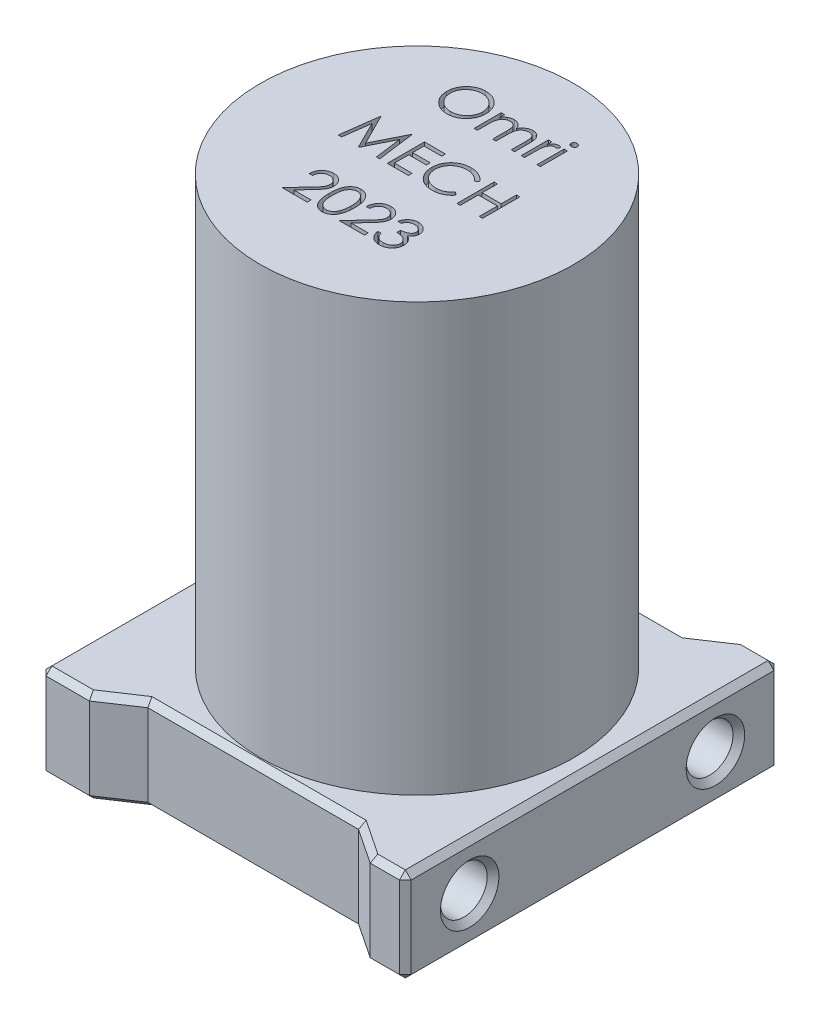
from build123d import *

# Parameters (mm, degrees)
SKETCH1_R                 = 13.4
BOSS_EXTRUDE1_DEPTH       = 36.5
SKETCH2_W                 = 31.2
SKETCH2_H                 = 32
BOSS_EXTRUDE3_DEPTH       = 8
F_4_0MM_DOWEL_HOLE1_D     = 4
F_4_0MM_DOWEL_HOLE1_DEPTH = 10
F_4_0MM_DOWEL_HOLE1_TIP   = 1.201721238
F_4_0MM_DOWEL_HOLE2_D     = 4
F_4_0MM_DOWEL_HOLE2_DEPTH = 10
F_4_0MM_DOWEL_HOLE2_TIP   = 1.201721238
SKETCH12_W                = 0.284935898
SKETCH12_H                = 2.320192308
CUT_EXTRUDE1_DEPTH        = 1
CUT_EXTRUDE2_DEPTH        = 8
CHAMFER2_SIZE             = 0.5


with BuildPart() as part:
    # Sketch1 → Boss-Extrude1 (new body)
    with BuildSketch(Plane(origin=(0, 0, 0), x_dir=(1, 0, 0), z_dir=(0, 1, 0))):
        with Locations(Location((0, 0, 0), (0, 0, 270))):
            Circle(SKETCH1_R)
    extrude(amount=BOSS_EXTRUDE1_DEPTH)

    # Sketch2 → Boss-Extrude3 (add)
    with BuildSketch(Plane.XZ):
        with Locations((-0.6, 0)):
            Rectangle(SKETCH2_W, SKETCH2_H)
    extrude(amount=BOSS_EXTRUDE3_DEPTH)

    # Ø4.0mm Dowel Hole1
    with Locations(Plane.ZY.offset(16.2)):
        with Locations((-10.5, -4), (10.5, -4)):
            Hole(F_4_0MM_DOWEL_HOLE1_D / 2, depth=F_4_0MM_DOWEL_HOLE1_DEPTH)
            with Locations((0, 0, -(F_4_0MM_DOWEL_HOLE1_DEPTH + F_4_0MM_DOWEL_HOLE1_TIP / 2))):  # 118° drill point
                Cone(0, F_4_0MM_DOWEL_HOLE1_D / 2, F_4_0MM_DOWEL_HOLE1_TIP, mode=Mode.SUBTRACT)

    # Ø4.0mm Dowel Hole2
    with Locations(Plane(origin=(15, 0, 0), x_dir=(0, 0, -1), z_dir=(1, 0, 0))):
        with Locations((-10.5, -4), (10.5, -4)):
            Hole(F_4_0MM_DOWEL_HOLE2_D / 2, depth=F_4_0MM_DOWEL_HOLE2_DEPTH)
            with Locations((0, 0, -(F_4_0MM_DOWEL_HOLE2_DEPTH + F_4_0MM_DOWEL_HOLE2_TIP / 2))):  # 118° drill point
                Cone(0, F_4_0MM_DOWEL_HOLE2_D / 2, F_4_0MM_DOWEL_HOLE2_TIP, mode=Mode.SUBTRACT)

    # Sketch12 → Cut-Extrude1 (cut)
    # profile 1 of 13: a face of its own
    with BuildSketch(Plane(origin=(0, 36.5, 0), x_dir=(1, 0, 0), z_dir=(0, 1, 0))):
        with BuildLine():
            add(Edge.make_bspline(
                [(-3.195352564, 9.066098338), (-3.136562354, 9.064609281), (-3.02109353, 9.061684652), (-2.851389873, 9.03929718), (-2.689378608, 9.000566361), (-2.533739982, 8.948983513), (-2.386335639, 8.880172749), (-2.246056072, 8.797001222), (-2.113235051, 8.698597577), (-1.989662798, 8.585722493), (-1.876581136, 8.46291036), (-1.776953367, 8.331848255), (-1.693457858, 8.193328628), (-1.624890751, 8.047767731), (-1.571098441, 7.89549476), (-1.533979023, 7.735697915), (-1.510267987, 7.56941256), (-1.50749596, 7.455995333), (-1.506089744, 7.398460117)],
                knots=[0, 0, 0, 0, 1.065120563, 2.091984664, 3.0946048, 4.079830382, 5.057816894, 6.036188127, 7.030412546, 8.04752943, 9.064399622, 10.05169764, 11.02544977, 11.989514704, 12.962713494, 13.945757189, 14.957906945, 16, 16, 16, 16], degree=3))
            add(Edge.make_bspline(
                [(-1.506089744, 7.398460117), (-1.507495754, 7.341348719), (-1.510267163, 7.228775537), (-1.534005982, 7.063545413), (-1.571236032, 6.904713138), (-1.624391217, 6.752543868), (-1.692631472, 6.606877078), (-1.776682949, 6.468096055), (-1.875689619, 6.336155303), (-1.988362976, 6.212500243), (-2.111191064, 6.09910968), (-2.242935664, 6.0003047), (-2.38063389, 5.91528353), (-2.526057696, 5.847444054), (-2.677278444, 5.793222383), (-2.835649551, 5.756253926), (-3.000428925, 5.732407822), (-3.112797622, 5.729669597), (-3.169911859, 5.728277825)],
                knots=[0, 0, 0, 0, 1.043624062, 2.057103931, 3.04512605, 4.022047818, 4.998200453, 5.980619268, 6.982898556, 8.009068085, 9.034988726, 10.034168286, 11.015286542, 11.987931943, 12.962482838, 13.94673481, 14.956375938, 16, 16, 16, 16], degree=3))
            add(Edge.make_bspline(
                [(-3.169911859, 5.728277825), (-3.227446777, 5.72968334), (-3.340863416, 5.732453985), (-3.507357726, 5.756204259), (-3.667266823, 5.79334387), (-3.820133413, 5.846420288), (-3.966042742, 5.915015918), (-4.105280174, 5.998658462), (-4.237286829, 6.097906369), (-4.36096827, 6.21054319), (-4.474133614, 6.333163098), (-4.572793905, 6.464548458), (-4.656455258, 6.602121622), (-4.724820567, 6.746264376), (-4.778944755, 6.896279899), (-4.81586984, 7.053168875), (-4.839760311, 7.216036855), (-4.84251335, 7.326928627), (-4.843910256, 7.383195693)],
                knots=[0, 0, 0, 0, 1.053102029, 2.075944431, 3.073151272, 4.055350789, 5.033113405, 6.020478099, 7.024410459, 8.052272461, 9.079885166, 10.07527673, 11.055994387, 12.023226415, 12.992069828, 13.970394897, 14.97016774, 16, 16, 16, 16], degree=3))
            add(Edge.make_bspline(
                [(-4.843910256, 7.383195693), (-4.843425266, 7.420962472), (-4.842461402, 7.496019584), (-4.83085751, 7.607477143), (-4.814019395, 7.717142239), (-4.78988766, 7.824703028), (-4.758326648, 7.929896207), (-4.721086595, 8.033447256), (-4.675602592, 8.134306777), (-4.624185147, 8.232952568), (-4.56679765, 8.327846882), (-4.503410363, 8.41754479), (-4.436249707, 8.50279898), (-4.362622914, 8.581400191), (-4.284956568, 8.655635007), (-4.201990753, 8.724362615), (-4.114231717, 8.788202749), (-4.021301844, 8.845734059), (-3.925490981, 8.897766988), (-3.826724189, 8.942418238), (-3.726342871, 8.980741451), (-3.623876869, 9.011802771), (-3.519598283, 9.03632469), (-3.413279521, 9.053022789), (-3.305005284, 9.064656277), (-3.232060731, 9.065615583), (-3.195352564, 9.066098338)],
                knots=[0, 0, 0, 0, 1.037015668, 2.060948919, 3.074880161, 4.083647147, 5.086022904, 6.090072063, 7.104153813, 8.122640571, 9.144368836, 10.147691507, 11.138137339, 12.123020368, 13.103399296, 14.087645067, 15.080126199, 16.082011238, 17.087798457, 18.072939717, 19.057185487, 20.037253025, 21.01195951, 21.997135196, 22.992090687, 24, 24, 24, 24], degree=3))
        make_face()
        with BuildLine():
            add(Edge.make_bspline(
                [(-3.181360176, 8.740457312), (-3.211490594, 8.740090019), (-3.27146338, 8.739358944), (-3.360621495, 8.729728973), (-3.448607035, 8.716004002), (-3.535438171, 8.69642648), (-3.62075159, 8.669752803), (-3.705342518, 8.639054265), (-3.788439574, 8.601660847), (-3.869768431, 8.559412751), (-3.94861282, 8.512650516), (-4.023010057, 8.460968984), (-4.093152741, 8.405580153), (-4.158869133, 8.346354758), (-4.219966267, 8.28299119), (-4.277646675, 8.216450052), (-4.329598367, 8.144829408), (-4.377210283, 8.070071396), (-4.419816824, 7.99227339), (-4.457703967, 7.912254444), (-4.488695604, 7.829361828), (-4.513970759, 7.744494842), (-4.534925588, 7.657787896), (-4.548200647, 7.568583234), (-4.557936431, 7.477329096), (-4.558625719, 7.415659843), (-4.558974359, 7.384467729)],
                knots=[0, 0, 0, 0, 1.008559885, 2.007477868, 2.99961109, 3.989939068, 4.984837346, 5.991145699, 7.001802488, 8.033829008, 9.059044045, 10.069351652, 11.065060232, 12.050310815, 13.029377138, 14.011219647, 14.996725999, 15.989392538, 16.977580475, 17.965360261, 18.951710183, 19.937753436, 20.929683414, 21.935841486, 22.955955122, 24, 24, 24, 24], degree=3))
            add(Edge.make_bspline(
                [(-4.558974359, 7.384467729), (-4.557817877, 7.338600571), (-4.555542719, 7.248365683), (-4.535624066, 7.116133153), (-4.504942704, 6.989053064), (-4.45971495, 6.867820761), (-4.403154035, 6.751394161), (-4.333279642, 6.640806095), (-4.250494614, 6.536026673), (-4.156456987, 6.437787394), (-4.053657103, 6.348120128), (-3.944498126, 6.269413322), (-3.830149497, 6.202819738), (-3.71031302, 6.148567994), (-3.585628467, 6.105578732), (-3.455292403, 6.076115974), (-3.320173057, 6.056725382), (-3.228070249, 6.054863239), (-3.181360176, 6.053918851)],
                knots=[0, 0, 0, 0, 1.032063989, 2.030389145, 3.003944642, 3.970395727, 4.937377036, 5.913328081, 6.909231446, 7.93887556, 8.970685674, 9.976071282, 10.964166581, 11.944589148, 12.933237628, 13.927779006, 14.949070134, 16, 16, 16, 16], degree=3))
            add(Edge.make_bspline(
                [(-3.181360176, 6.053918851), (-3.149964414, 6.054350201), (-3.087697188, 6.055205698), (-2.995081964, 6.063822355), (-2.904135258, 6.077639837), (-2.814984633, 6.097534074), (-2.727731268, 6.122432612), (-2.642010982, 6.152012479), (-2.558736819, 6.188916142), (-2.476858252, 6.229690356), (-2.398484518, 6.276172499), (-2.323667428, 6.326099963), (-2.25429279, 6.381407212), (-2.18862556, 6.439752656), (-2.127277585, 6.502312718), (-2.070663721, 6.569006062), (-2.018974601, 6.640253658), (-1.971380765, 6.714898276), (-1.928923519, 6.792909163), (-1.891931051, 6.873218228), (-1.860547431, 6.95562772), (-1.835212288, 7.040256502), (-1.815359048, 7.126943844), (-1.801679406, 7.215805815), (-1.792110465, 7.306664647), (-1.791389217, 7.368118002), (-1.791025641, 7.399096134)],
                knots=[0, 0, 0, 0, 1.047197238, 2.076906641, 3.100256066, 4.114471768, 5.12198147, 6.126382909, 7.136867548, 8.15857795, 9.17633901, 10.174870724, 11.156907918, 12.133735059, 13.104061851, 14.077631395, 15.04955518, 16.038496417, 17.029181396, 18.010275684, 18.986308667, 19.968651475, 20.955262928, 21.950658345, 22.966943676, 24, 24, 24, 24], degree=3))
            add(Edge.make_bspline(
                [(-1.791025641, 7.399096134), (-1.791389508, 7.429862342), (-1.792111305, 7.490892781), (-1.801674835, 7.581117952), (-1.8153735, 7.669340509), (-1.835115385, 7.755214101), (-1.860560882, 7.83876062), (-1.891936531, 7.919901599), (-1.928934625, 7.998939318), (-1.971396371, 8.075678431), (-2.019126439, 8.149315515), (-2.071281932, 8.219711989), (-2.128763354, 8.285545833), (-2.189928391, 8.348442305), (-2.256304837, 8.407059962), (-2.327592018, 8.461418249), (-2.402924497, 8.512829005), (-2.482687061, 8.559207193), (-2.56500479, 8.602037247), (-2.649472452, 8.638732085), (-2.735133136, 8.669912508), (-2.821769009, 8.696507183), (-2.910109282, 8.715927325), (-2.999557041, 8.729741342), (-3.089988533, 8.739355592), (-3.150806311, 8.740088907), (-3.181360176, 8.740457312)],
                knots=[0, 0, 0, 0, 1.02996197, 2.043119294, 3.035359645, 4.018872909, 4.991431989, 5.957985074, 6.929999688, 7.912076566, 8.892894881, 9.867085534, 10.843653904, 11.817741046, 12.803660682, 13.806313499, 14.818574707, 15.856120519, 16.894564902, 17.924820532, 18.937903209, 19.946497019, 20.957711757, 21.963978472, 22.977135795, 24, 24, 24, 24], degree=3))
        make_face(mode=Mode.SUBTRACT)
    # profile 2 of 13: a face of its own
    with BuildSketch(Plane(origin=(0, 36.5, 0), x_dir=(1, 0, 0), z_dir=(0, 1, 0))):
        with BuildLine():
            Line((-0.936217949, 8.129880389), (-0.651282051, 8.129880389))
            Line((-0.651282051, 8.129880389), (-0.651282051, 7.726645213))
            add(Edge.make_bspline(
                [(-0.651282051, 7.726645213), (-0.625624468, 7.761921823), (-0.576462079, 7.82951519), (-0.495848237, 7.918587805), (-0.415315621, 7.994178345), (-0.35731891, 8.033859379), (-0.329457131, 8.052922256)],
                knots=[0, 0, 0, 0, 1.134379233, 2.173579362, 3.122582517, 4, 4, 4, 4], degree=3))
            add(Edge.make_bspline(
                [(-0.329457131, 8.052922256), (-0.291479902, 8.07106998), (-0.21618895, 8.107048367), (-0.096972939, 8.143545952), (0.025014797, 8.165975151), (0.107390819, 8.16904254), (0.148828125, 8.170585517)],
                knots=[0, 0, 0, 0, 1.014936303, 2.012140481, 3.000054389, 4, 4, 4, 4], degree=3))
            add(Edge.make_bspline(
                [(0.148828125, 8.170585517), (0.176852486, 8.169637289), (0.23231119, 8.167760797), (0.3144839, 8.155550622), (0.394184212, 8.134444879), (0.470941225, 8.105046807), (0.54325927, 8.069444455), (0.609561613, 8.027670792), (0.669092145, 7.980774159), (0.721820777, 7.926636841), (0.76923625, 7.863738641), (0.812850633, 7.790383215), (0.853150647, 7.704923408), (0.875485691, 7.642905189), (0.887244591, 7.610253987)],
                knots=[0, 0, 0, 0, 1.009824226, 1.998387844, 2.986035974, 3.974953746, 4.955485308, 5.885931332, 6.793869504, 7.679848016, 8.601185859, 9.625726857, 10.749998409, 12, 12, 12, 12], degree=3))
            add(Edge.make_bspline(
                [(0.887244591, 7.610253987), (0.899682655, 7.632682567), (0.924159018, 7.676818863), (0.965257703, 7.739283144), (1.008317775, 7.797709305), (1.053706208, 7.852143705), (1.101262798, 7.902317531), (1.151211354, 7.948396671), (1.203267548, 7.990579008), (1.275650509, 8.039857874), (1.369823374, 8.092201088), (1.488557592, 8.137584034), (1.612065248, 8.165629379), (1.695901303, 8.168922555), (1.738236178, 8.170585517)],
                knots=[0, 0, 0, 0, 0.86119277, 1.694706429, 2.50939023, 3.298075842, 4.073795165, 4.829715201, 5.57930267, 6.321991688, 7.768977793, 9.186738141, 10.579381044, 12, 12, 12, 12], degree=3))
            add(Edge.make_bspline(
                [(1.738236178, 8.170585517), (1.777135791, 8.169118467), (1.85326611, 8.166247307), (1.964098343, 8.143701656), (2.067459838, 8.104986933), (2.163142614, 8.052160706), (2.249466159, 7.985776732), (2.324501669, 7.906792858), (2.387793355, 7.815767765), (2.429139693, 7.730140746), (2.457184254, 7.654543694), (2.474475516, 7.590130844), (2.489751526, 7.519236221), (2.502434512, 7.441775056), (2.511704199, 7.357473718), (2.518571919, 7.266470166), (2.523220186, 7.168693672), (2.523548637, 7.10123354), (2.523717949, 7.066458915)],
                knots=[0, 0, 0, 0, 1.209669288, 2.367440248, 3.500751976, 4.631527125, 5.755587489, 6.87532382, 8.007944318, 9.190864318, 9.82315674, 10.514484317, 11.263564316, 12.079023757, 12.955305781, 13.901327259, 14.918167583, 16, 16, 16, 16], degree=3))
            Line((2.523717949, 7.066458915), (2.523717949, 5.809688081))
            Line((2.523717949, 5.809688081), (2.238782051, 5.809688081))
            Line((2.238782051, 5.809688081), (2.238782051, 7.06773095))
            add(Edge.make_bspline(
                [(2.238782051, 7.06773095), (2.2387114, 7.097413185), (2.23857562, 7.154457926), (2.236132111, 7.236329793), (2.231528076, 7.310958945), (2.226144511, 7.378243625), (2.218666198, 7.438340741), (2.209008817, 7.491129577), (2.198778351, 7.537025392), (2.18178213, 7.587903449), (2.154615114, 7.644028569), (2.113233543, 7.704556384), (2.061099947, 7.757243967), (2.000901805, 7.802980583), (1.932368573, 7.840167672), (1.856835574, 7.866725195), (1.774771756, 7.883165235), (1.71796394, 7.884803549), (1.688626803, 7.88564962)],
                knots=[0, 0, 0, 0, 1.253487763, 2.409012846, 3.458416907, 4.410876679, 5.259312806, 6.014470957, 6.676830364, 7.243083969, 8.276244668, 9.299465089, 10.325150304, 11.392391894, 12.482080715, 13.603491619, 14.762376348, 16, 16, 16, 16], degree=3))
            add(Edge.make_bspline(
                [(1.688626803, 7.88564962), (1.652640487, 7.884364963), (1.581517846, 7.881825992), (1.477699441, 7.855905407), (1.377940019, 7.816825466), (1.285216291, 7.760190308), (1.199919652, 7.692328435), (1.126532178, 7.611638445), (1.065905838, 7.520352725), (1.024854017, 7.43585536), (0.998919437, 7.359955221), (0.981795378, 7.293645462), (0.968475444, 7.218278611), (0.955983607, 7.134361102), (0.947830454, 7.041315295), (0.940420573, 6.939571603), (0.936954504, 6.828824011), (0.936469674, 6.752055515), (0.936217949, 6.712197096)],
                knots=[0, 0, 0, 0, 1.090531906, 2.155305635, 3.229839962, 4.33261226, 5.44038871, 6.529323825, 7.629011124, 8.757537029, 9.370236727, 10.061839251, 10.834451254, 11.692844982, 12.636905849, 13.66920014, 14.789842145, 16, 16, 16, 16], degree=3))
            Line((0.936217949, 6.712197096), (0.936217949, 5.809688081))
            Line((0.936217949, 5.809688081), (0.651282051, 5.809688081))
            Line((0.651282051, 5.809688081), (0.651282051, 6.989500782))
            add(Edge.make_bspline(
                [(0.651282051, 6.989500782), (0.651209996, 7.022786864), (0.651071369, 7.08682594), (0.648643567, 7.178659345), (0.644029274, 7.262190039), (0.638694777, 7.337320939), (0.631020186, 7.403915501), (0.622302759, 7.462330746), (0.612007948, 7.512420227), (0.594962839, 7.567359869), (0.568914714, 7.627885278), (0.527015362, 7.692420347), (0.474757057, 7.748906407), (0.41346062, 7.797128986), (0.344512608, 7.836990187), (0.268327666, 7.865710105), (0.18559178, 7.882423567), (0.128552719, 7.884553989), (0.09921875, 7.88564962)],
                knots=[0, 0, 0, 0, 1.320475261, 2.540461679, 3.643808994, 4.639130445, 5.527981419, 6.302341397, 6.981980563, 7.553956391, 8.582137848, 9.585246428, 10.591171744, 11.620968678, 12.668337649, 13.738356861, 14.836885341, 16, 16, 16, 16], degree=3))
            add(Edge.make_bspline(
                [(0.09921875, 7.88564962), (0.064732615, 7.884261274), (-0.003997026, 7.88149435), (-0.104963813, 7.856589401), (-0.202468683, 7.817578562), (-0.29495616, 7.763458583), (-0.379931995, 7.696421562), (-0.454325209, 7.617577335), (-0.516865928, 7.527907141), (-0.558351217, 7.444300758), (-0.585110547, 7.370302144), (-0.602886315, 7.307390927), (-0.618162262, 7.237540702), (-0.629514267, 7.160535966), (-0.64047293, 7.076878259), (-0.645761853, 6.986150829), (-0.65090677, 6.888431506), (-0.651153889, 6.820964983), (-0.651282051, 6.785975141)],
                knots=[0, 0, 0, 0, 1.098833095, 2.189935336, 3.297829714, 4.440610912, 5.596351641, 6.740013378, 7.886572111, 9.072425424, 9.705826452, 10.395263256, 11.156850408, 11.985370555, 12.878090359, 13.847760091, 14.883794034, 16, 16, 16, 16], degree=3))
            Line((-0.651282051, 6.785975141), (-0.651282051, 5.809688081))
            Line((-0.651282051, 5.809688081), (-0.936217949, 5.809688081))
            Line((-0.936217949, 5.809688081), (-0.936217949, 8.129880389))
        make_face()
    # profile 3 of 13: a face of its own
    with BuildSketch(Plane(origin=(0, 36.5, 0), x_dir=(1, 0, 0), z_dir=(0, 1, 0))):
        with BuildLine():
            Line((3.093589744, 8.129880389), (3.378525641, 8.129880389))
            Line((3.378525641, 8.129880389), (3.378525641, 7.788338923))
            add(Edge.make_bspline(
                [(3.378525641, 7.788338923), (3.399561158, 7.820139567), (3.43979142, 7.880958052), (3.506659578, 7.961393775), (3.575151885, 8.02799171), (3.645596234, 8.081062759), (3.718510653, 8.120807517), (3.792294888, 8.149920485), (3.868109778, 8.167135621), (3.919056667, 8.169434011), (3.94458133, 8.170585517)],
                knots=[0, 0, 0, 0, 1.2804753, 2.448899062, 3.506932113, 4.484331642, 5.4025378, 6.288909075, 7.142734305, 8, 8, 8, 8], degree=3))
            add(Edge.make_bspline(
                [(3.94458133, 8.170585517), (3.964380926, 8.16950554), (4.005119882, 8.167283415), (4.066789803, 8.151670739), (4.13032922, 8.126744247), (4.171279814, 8.103303473), (4.192628205, 8.091083314)],
                knots=[0, 0, 0, 0, 0.901110191, 1.854092781, 2.881294221, 4, 4, 4, 4], degree=3))
            Line((4.192628205, 8.091083314), (4.036167869, 7.844308474))
            add(Edge.make_bspline(
                [(4.036167869, 7.844308474), (4.022461828, 7.850422858), (3.996445139, 7.86202913), (3.958386354, 7.875765096), (3.923296856, 7.883853106), (3.900941628, 7.885078399), (3.890519832, 7.88564962)],
                knots=[0, 0, 0, 0, 1.180555205, 2.24091978, 3.179933427, 4, 4, 4, 4], degree=3))
            add(Edge.make_bspline(
                [(3.890519832, 7.88564962), (3.867654631, 7.884125586), (3.821016248, 7.881016998), (3.752541024, 7.856579651), (3.686095345, 7.817096041), (3.633325337, 7.773307246), (3.592465579, 7.731081744), (3.563309803, 7.694207836), (3.536564739, 7.652861506), (3.511010325, 7.607749579), (3.48772733, 7.55810179), (3.465997023, 7.504414161), (3.44634934, 7.446624508), (3.435145904, 7.406363222), (3.429407051, 7.385739764)],
                knots=[0, 0, 0, 0, 1.125678352, 2.296057538, 3.5422874, 4.923748041, 5.663163013, 6.437101912, 7.23742474, 8.08941207, 8.991984279, 9.93940061, 10.944477711, 12, 12, 12, 12], degree=3))
            add(Edge.make_bspline(
                [(3.429407051, 7.385739764), (3.425114094, 7.367345471), (3.415605521, 7.326603509), (3.406360341, 7.258251633), (3.397225849, 7.177494457), (3.390788203, 7.084107191), (3.384820979, 6.978323045), (3.381455404, 6.859980866), (3.378640412, 6.728959183), (3.378565059, 6.63736102), (3.378525641, 6.589445693)],
                knots=[0, 0, 0, 0, 0.566838948, 1.255505196, 2.06880316, 3.007127437, 4.065329342, 5.249902469, 6.561414163, 8, 8, 8, 8], degree=3))
            Line((3.378525641, 6.589445693), (3.378525641, 5.809688081))
            Line((3.378525641, 5.809688081), (3.093589744, 5.809688081))
            Line((3.093589744, 5.809688081), (3.093589744, 8.129880389))
        make_face()
    # profile 4 of 13: a face of its own
    with BuildSketch(Plane(origin=(0, 36.5, 0), x_dir=(1, 0, 0), z_dir=(0, 1, 0))):
        with BuildLine():
            add(Edge.make_bspline(
                [(4.578054888, 9.106803466), (4.595736296, 9.105983271), (4.630359888, 9.10437717), (4.680428067, 9.090623545), (4.726018356, 9.067310259), (4.766456728, 9.036032262), (4.801156654, 8.999248124), (4.825450584, 8.956375675), (4.841064686, 8.910058195), (4.842950233, 8.877750221), (4.843910256, 8.861300661)],
                knots=[0, 0, 0, 0, 1.055194115, 2.066272739, 3.074728998, 4.095836921, 5.109056067, 6.073838105, 7.019297344, 8, 8, 8, 8], degree=3))
            add(Edge.make_bspline(
                [(4.843910256, 8.861300661), (4.842928583, 8.845278112), (4.84098793, 8.813603427), (4.825462645, 8.768088921), (4.800949615, 8.725812178), (4.766478979, 8.689099462), (4.72601246, 8.657838757), (4.680429633, 8.634520886), (4.630359476, 8.620768476), (4.595736156, 8.619162208), (4.578054888, 8.618341927)],
                knots=[0, 0, 0, 0, 0.96129708, 1.900370562, 2.859976407, 3.87933698, 4.906634145, 5.921202961, 6.938410037, 8, 8, 8, 8], degree=3))
            add(Edge.make_bspline(
                [(4.578054888, 8.618341927), (4.56057581, 8.619130888), (4.526555068, 8.620666496), (4.477236575, 8.634790727), (4.432035017, 8.657846736), (4.391517778, 8.688894775), (4.357744674, 8.726037646), (4.333162622, 8.76806312), (4.317673192, 8.813609996), (4.315727708, 8.845280318), (4.31474359, 8.861300661)],
                knots=[0, 0, 0, 0, 1.054934014, 2.053291228, 3.073705704, 4.106921865, 5.123545215, 6.088680038, 7.033164197, 8, 8, 8, 8], degree=3))
            add(Edge.make_bspline(
                [(4.31474359, 8.861300661), (4.315706147, 8.877747932), (4.31759667, 8.91005141), (4.333174232, 8.956401904), (4.357539915, 8.999020838), (4.391540141, 9.036236826), (4.432029065, 9.067302328), (4.477238113, 9.090353718), (4.526554661, 9.104479147), (4.560575672, 9.10601459), (4.578054888, 9.106803466)],
                knots=[0, 0, 0, 0, 0.98631895, 1.937192651, 2.907499808, 3.917963147, 4.944918757, 5.95915025, 6.951458133, 8, 8, 8, 8], degree=3))
        make_face()
    # profile 5 of 13: a face of its own
    with BuildSketch(Plane(origin=(0, 36.5, 0), x_dir=(1, 0, 0), z_dir=(0, 1, 0))):
        with Locations((4.579326923, 6.969784235)):
            Rectangle(SKETCH12_W, SKETCH12_H)
    # profile 6 of 13: a face of its own
    with BuildSketch(Plane(origin=(0, 36.5, 0), x_dir=(1, 0, 0), z_dir=(0, 1, 0))):
        Polygon((-6.248237179, -0.481978585), (-5.829101563, 2.693021415), (-5.788396434, 2.693021415), (-4.477564103, 0.08789321), (-3.169911859, 2.693021415), (-3.128570713, 2.693021415), (-2.706891026, -0.481978585), (-2.993098958, -0.481978585), (-3.297115385, 1.802596735), (-4.443219151, -0.481978585), (-4.507456931, -0.481978585), (-5.658012821, 1.807684876), (-5.961393229, -0.481978585), align=None)
    # profile 7 of 13: a face of its own
    with BuildSketch(Plane(origin=(0, 36.5, 0), x_dir=(1, 0, 0), z_dir=(0, 1, 0))):
        Polygon((-2.055608974, 2.693021415), (-0.264583333, 2.693021415), (-0.264583333, 2.367380389), (-1.770673077, 2.367380389), (-1.770673077, 1.390457312), (-0.264583333, 1.390457312), (-0.264583333, 1.064816286), (-1.770673077, 1.064816286), (-1.770673077, -0.15633756), (-0.264583333, -0.15633756), (-0.264583333, -0.481978585), (-2.055608974, -0.481978585), align=None)
    # profile 8 of 13: a face of its own
    with BuildSketch(Plane(origin=(0, 36.5, 0), x_dir=(1, 0, 0), z_dir=(0, 1, 0))):
        with BuildLine():
            Line((3.236057692, 2.110429267), (2.986738782, 1.919623979))
            add(Edge.make_bspline(
                [(2.986738782, 1.919623979), (2.96895344, 1.940820251), (2.933622542, 1.982927025), (2.876781694, 2.042054183), (2.817543775, 2.097449099), (2.75593143, 2.149375661), (2.690835657, 2.196018013), (2.623833361, 2.239806799), (2.553803706, 2.279056819), (2.456964632, 2.326648242), (2.330284084, 2.376310825), (2.170813052, 2.417951614), (2.004342269, 2.444459394), (1.890770161, 2.447330358), (1.833002804, 2.448790645)],
                knots=[0, 0, 0, 0, 0.757959112, 1.505699292, 2.245454638, 2.979532153, 3.711538275, 4.438200793, 5.171680507, 5.909471876, 7.393775596, 8.890124382, 10.418191784, 12, 12, 12, 12], degree=3))
            add(Edge.make_bspline(
                [(1.833002804, 2.448790645), (1.80117724, 2.448424194), (1.737821483, 2.447694691), (1.64379751, 2.438070699), (1.551529242, 2.424544101), (1.461076698, 2.404473273), (1.372555014, 2.379098111), (1.285385478, 2.348776485), (1.200830148, 2.311261738), (1.117719318, 2.269797816), (1.038091034, 2.222964349), (0.96274824, 2.171880094), (0.891965726, 2.117116699), (0.8256875, 2.05846891), (0.763845804, 1.996200846), (0.706888743, 1.929648907), (0.655013407, 1.859025864), (0.607191534, 1.785262987), (0.56436284, 1.708575133), (0.528503592, 1.628678462), (0.496748946, 1.546941169), (0.471621776, 1.462439759), (0.451733107, 1.375768821), (0.438010155, 1.286695749), (0.428495614, 1.195406625), (0.427769739, 1.133531035), (0.427403846, 1.102341327)],
                knots=[0, 0, 0, 0, 1.054917814, 2.100044995, 3.131103042, 4.146048494, 5.169673617, 6.183595914, 7.203665975, 8.234915748, 9.262203917, 10.264457458, 11.251630812, 12.227803204, 13.197192746, 14.159520551, 15.12972552, 16.100847026, 17.073214652, 18.039054194, 19.002613845, 19.979014051, 20.95965708, 21.949030935, 22.966165397, 24, 24, 24, 24], degree=3))
            add(Edge.make_bspline(
                [(0.427403846, 1.102341327), (0.428548496, 1.055413629), (0.430795865, 0.96327732), (0.450796854, 0.828321123), (0.481190758, 0.699034512), (0.52674346, 0.576225655), (0.582912884, 0.458380216), (0.653888296, 0.347492113), (0.736090441, 0.241885658), (0.830682236, 0.144056699), (0.934464654, 0.054690676), (1.045814546, -0.024004494), (1.164454578, -0.089604423), (1.289074807, -0.144192603), (1.42063421, -0.186154063), (1.55889621, -0.215694375), (1.703560091, -0.234964068), (1.802410904, -0.236808913), (1.852719351, -0.237747816)],
                knots=[0, 0, 0, 0, 1.029171465, 2.020641659, 2.987623507, 3.938342917, 4.889210282, 5.84687017, 6.821220943, 7.821438502, 8.827599549, 9.822697543, 10.807740252, 11.797342354, 12.80366471, 13.83203677, 14.896651826, 16, 16, 16, 16], degree=3))
            add(Edge.make_bspline(
                [(1.852719351, -0.237747816), (1.908148219, -0.236215852), (2.01724549, -0.233200579), (2.177236486, -0.207656117), (2.330394645, -0.166237863), (2.476728205, -0.108273319), (2.615824634, -0.032921237), (2.747901605, 0.058426123), (2.873070601, 0.166637682), (2.948337407, 0.249263092), (2.986738782, 0.291418851)],
                knots=[0, 0, 0, 0, 1.028121516, 2.023589091, 2.998037872, 3.967518031, 4.937445131, 5.927275754, 6.942489185, 8, 8, 8, 8], degree=3))
            Line((2.986738782, 0.291418851), (3.236057692, 0.102521615))
            add(Edge.make_bspline(
                [(3.236057692, 0.102521615), (3.215993407, 0.076633162), (3.175960943, 0.024980261), (3.111138313, -0.047837647), (3.042851051, -0.116330594), (2.970591942, -0.179946365), (2.895192231, -0.239957915), (2.815298062, -0.294660291), (2.731959726, -0.344817022), (2.645459591, -0.390742875), (2.555889564, -0.431489234), (2.463356969, -0.466372295), (2.368260662, -0.496421302), (2.270596293, -0.521142702), (2.170161285, -0.540438614), (2.067318069, -0.55333789), (1.961844683, -0.562175198), (1.890687108, -0.562980665), (1.854627404, -0.563388842)],
                knots=[0, 0, 0, 0, 0.986787822, 1.968848986, 2.935600012, 3.899624008, 4.868462664, 5.837806735, 6.815139263, 7.798259679, 8.787526145, 9.778297419, 10.776456485, 11.791383307, 12.812564526, 13.85620153, 14.913611965, 16, 16, 16, 16], degree=3))
            add(Edge.make_bspline(
                [(1.854627404, -0.563388842), (1.82047922, -0.563151177), (1.752955416, -0.562681225), (1.653261548, -0.55506833), (1.556206714, -0.544681783), (1.462068303, -0.529042521), (1.370332597, -0.510587298), (1.28183121, -0.485848373), (1.195693269, -0.458135914), (1.112264846, -0.425564962), (1.031474975, -0.388810997), (0.953584232, -0.347271511), (0.87862844, -0.301295819), (0.805870665, -0.251897346), (0.736385714, -0.197489365), (0.669571445, -0.138827489), (0.605053199, -0.076109437), (0.565136477, -0.030883962), (0.545067107, -0.008145452)],
                knots=[0, 0, 0, 0, 1.114604814, 2.203992996, 3.262667896, 4.300477797, 5.318619304, 6.316056647, 7.298880507, 8.271930387, 9.238335007, 10.195173496, 11.151986948, 12.108099108, 13.064862484, 14.031167946, 15.010108607, 16, 16, 16, 16], degree=3))
            add(Edge.make_bspline(
                [(0.545067107, -0.008145452), (0.512921916, 0.031352626), (0.44901962, 0.109871928), (0.36726275, 0.237131354), (0.297278896, 0.369998943), (0.240695025, 0.509172736), (0.19646026, 0.654340437), (0.16581589, 0.805575225), (0.145902649, 0.962735858), (0.143625458, 1.069630659), (0.142467949, 1.123965926)],
                knots=[0, 0, 0, 0, 0.994628077, 1.977248131, 2.950237994, 3.925870899, 4.908910175, 5.911660606, 6.938484602, 8, 8, 8, 8], degree=3))
            add(Edge.make_bspline(
                [(0.142467949, 1.123965926), (0.143878731, 1.181075516), (0.146654358, 1.293435069), (0.170236259, 1.458330012), (0.208171881, 1.61631021), (0.262053344, 1.767080749), (0.330366056, 1.911434647), (0.414754484, 2.048269168), (0.514238249, 2.178459408), (0.628037114, 2.300029932), (0.752830339, 2.411190631), (0.886469549, 2.508986258), (1.028693172, 2.590372862), (1.177934366, 2.658405095), (1.335310663, 2.710696858), (1.500486291, 2.747302963), (1.673150878, 2.770087776), (1.79095465, 2.772968143), (1.850811298, 2.774431671)],
                knots=[0, 0, 0, 0, 1.032925535, 2.032216505, 3.007276963, 3.968222605, 4.92396291, 5.891752235, 6.871517503, 7.883894988, 8.900124299, 9.891468569, 10.874487609, 11.85992873, 12.854644235, 13.869047385, 14.917252991, 16, 16, 16, 16], degree=3))
            add(Edge.make_bspline(
                [(1.850811298, 2.774431671), (1.887291569, 2.773994303), (1.959500592, 2.773128576), (2.066319069, 2.764686576), (2.170316037, 2.750613519), (2.271563142, 2.731458227), (2.370552944, 2.707684443), (2.466528877, 2.676714315), (2.560054114, 2.641302604), (2.65053881, 2.600518853), (2.737548823, 2.554738309), (2.821057055, 2.504468422), (2.900400177, 2.449771513), (2.976136489, 2.391112775), (3.046999052, 2.327251225), (3.114999822, 2.259943406), (3.177829514, 2.187250579), (3.21661277, 2.136083247), (3.236057692, 2.110429267)],
                knots=[0, 0, 0, 0, 1.096760587, 2.17092713, 3.219439832, 4.250915756, 5.268269357, 6.278326846, 7.281116186, 8.274029601, 9.260640565, 10.235837813, 11.203064059, 12.156899882, 13.114053108, 14.069676657, 15.032185724, 16, 16, 16, 16], degree=3))
        make_face()
    # profile 9 of 13: a face of its own
    with BuildSketch(Plane(origin=(0, 36.5, 0), x_dir=(1, 0, 0), z_dir=(0, 1, 0))):
        Polygon((3.887339744, 2.693021415), (4.172275641, 2.693021415), (4.172275641, 1.390457312), (5.800480769, 1.390457312), (5.800480769, 2.693021415), (6.085416667, 2.693021415), (6.085416667, -0.481978585), (5.800480769, -0.481978585), (5.800480769, 1.064816286), (4.172275641, 1.064816286), (4.172275641, -0.481978585), (3.887339744, -0.481978585), align=None)
    # profile 10 of 13: a face of its own
    with BuildSketch(Plane(origin=(0, 36.5, 0), x_dir=(1, 0, 0), z_dir=(0, 1, 0))):
        with BuildLine():
            Line((-4.355448718, -4.575568329), (-4.640384615, -4.575568329))
            add(Edge.make_bspline(
                [(-4.640384615, -4.575568329), (-4.638527555, -4.537766881), (-4.634880338, -4.463525843), (-4.61780039, -4.355282013), (-4.593361166, -4.251818017), (-4.558806775, -4.153964595), (-4.515893223, -4.060856534), (-4.464430984, -3.972863663), (-4.403476563, -3.890321656), (-4.334346168, -3.813995705), (-4.259263189, -3.743975552), (-4.178249944, -3.683509724), (-4.093119097, -3.632421551), (-4.004128928, -3.589712139), (-3.910275417, -3.55765385), (-3.812410253, -3.533867077), (-3.710103465, -3.519555678), (-3.640398588, -3.518017358), (-3.604947917, -3.517234996)],
                knots=[0, 0, 0, 0, 1.10065271, 2.161652631, 3.183658789, 4.190468796, 5.17591951, 6.163126047, 7.15150782, 8.156236427, 9.156009102, 10.134482811, 11.092018607, 12.041330605, 13.001268258, 13.972401359, 14.968799086, 16, 16, 16, 16], degree=3))
            add(Edge.make_bspline(
                [(-3.604947917, -3.517234996), (-3.570133521, -3.518050024), (-3.501724477, -3.519651526), (-3.401882507, -3.533404745), (-3.306834532, -3.554945389), (-3.216766344, -3.585167231), (-3.132396557, -3.625793104), (-3.053091367, -3.674595157), (-2.977906631, -3.731037433), (-2.91022762, -3.797489106), (-2.848081005, -3.868429841), (-2.794466817, -3.944165296), (-2.748553447, -4.022387577), (-2.710283195, -4.10369316), (-2.68211084, -4.188847593), (-2.660722037, -4.276611127), (-2.648632169, -4.367892205), (-2.646776678, -4.429674581), (-2.645833333, -4.461085156)],
                knots=[0, 0, 0, 0, 1.111607364, 2.184268762, 3.212621178, 4.221274766, 5.211760367, 6.196651075, 7.1921475, 8.207485113, 9.220403448, 10.201281604, 11.166441695, 12.114753415, 13.065576456, 14.026450734, 14.996634279, 16, 16, 16, 16], degree=3))
            add(Edge.make_bspline(
                [(-2.645833333, -4.461085156), (-2.647369365, -4.505306406), (-2.650414472, -4.592972885), (-2.676462514, -4.721800654), (-2.717144706, -4.846617541), (-2.766128022, -4.947072094), (-2.815542311, -5.02801962), (-2.860071693, -5.094666231), (-2.912200486, -5.166426192), (-2.972687409, -5.243059205), (-3.040281229, -5.325165526), (-3.115594191, -5.412695555), (-3.19916335, -5.504744946), (-3.257817847, -5.567615027), (-3.288211138, -5.600192728)],
                knots=[0, 0, 0, 0, 1.184426356, 2.348067706, 3.509069118, 4.696110526, 5.333549288, 6.050745305, 6.844228056, 7.710549037, 8.667450064, 9.695053472, 10.805634456, 12, 12, 12, 12], degree=3))
            Line((-3.288211138, -5.600192728), (-4.082597155, -6.448004226))
            Line((-4.082597155, -6.448004226), (-2.605128205, -6.448004226))
            Line((-2.605128205, -6.448004226), (-2.605128205, -6.773645252))
            Line((-2.605128205, -6.773645252), (-4.7625, -6.773645252))
            Line((-4.7625, -6.773645252), (-3.531169872, -5.459632832))
            add(Edge.make_bspline(
                [(-3.531169872, -5.459632832), (-3.501190717, -5.42833794), (-3.443606897, -5.368226856), (-3.362161274, -5.280467171), (-3.289010192, -5.199051516), (-3.223680128, -5.124133719), (-3.167588305, -5.054617939), (-3.117811352, -4.992755601), (-3.07792828, -4.93582835), (-3.0346436, -4.869842221), (-2.992720917, -4.789276762), (-2.956696137, -4.690821201), (-2.93472981, -4.589468622), (-2.932094709, -4.520977488), (-2.930769231, -4.486525861)],
                knots=[0, 0, 0, 0, 1.329631726, 2.553950428, 3.673215718, 4.687767853, 5.603093632, 6.413772471, 7.123043292, 7.734684054, 8.834405432, 9.900288307, 10.943827018, 12, 12, 12, 12], degree=3))
            add(Edge.make_bspline(
                [(-2.930769231, -4.486525861), (-2.93134594, -4.464862021), (-2.932482523, -4.422166752), (-2.942513434, -4.359568671), (-2.95767225, -4.299184876), (-2.97939402, -4.240829628), (-3.008065849, -4.185089644), (-3.0429667, -4.131897073), (-3.083234829, -4.080472083), (-3.129817766, -4.032254448), (-3.180991074, -3.98809364), (-3.235051572, -3.948973934), (-3.292247023, -3.916281312), (-3.352336277, -3.88948114), (-3.41515181, -3.868457758), (-3.480815114, -3.853890333), (-3.549144758, -3.844744079), (-3.595802286, -3.843506581), (-3.619576322, -3.842876021)],
                knots=[0, 0, 0, 0, 0.991446411, 1.95395049, 2.89581595, 3.838931463, 4.798493298, 5.75982156, 6.748411868, 7.785213223, 8.824556874, 9.840280684, 10.836137867, 11.835679398, 12.848801643, 13.863922112, 14.911575587, 16, 16, 16, 16], degree=3))
            add(Edge.make_bspline(
                [(-3.619576322, -3.842876021), (-3.644405578, -3.843524658), (-3.693166136, -3.844798472), (-3.764756973, -3.853709032), (-3.833051928, -3.86908133), (-3.898222797, -3.890105885), (-3.96037985, -3.916828997), (-4.019220804, -3.950113651), (-4.074613568, -3.989831534), (-4.126662271, -4.03486261), (-4.174617452, -4.08499822), (-4.216751404, -4.140887258), (-4.253566902, -4.20150927), (-4.285688136, -4.266700684), (-4.311773655, -4.337053041), (-4.331706441, -4.412316602), (-4.347478795, -4.49216457), (-4.352747953, -4.547305325), (-4.355448718, -4.575568329)],
                knots=[0, 0, 0, 0, 1.031018746, 2.02475058, 2.990194455, 3.934040569, 4.864654155, 5.795059489, 6.735614925, 7.690564532, 8.649604399, 9.611025574, 10.590972636, 11.591080095, 12.624614302, 13.701020113, 14.821632451, 16, 16, 16, 16], degree=3))
        make_face()
    # profile 11 of 13: a face of its own
    with BuildSketch(Plane(origin=(0, 36.5, 0), x_dir=(1, 0, 0), z_dir=(0, 1, 0))):
        with BuildLine():
            add(Edge.make_bspline(
                [(-2.320192308, -5.187417287), (-2.319894748, -5.136528943), (-2.319316735, -5.0376776), (-2.312886525, -4.893637246), (-2.302204607, -4.758508984), (-2.287565704, -4.632286345), (-2.269751251, -4.514936745), (-2.24597006, -4.406773786), (-2.218925589, -4.307296858), (-2.187581584, -4.216181571), (-2.15221409, -4.132200369), (-2.113720153, -4.053800365), (-2.07057209, -3.981100183), (-2.02523589, -3.912939473), (-1.975876368, -3.850433979), (-1.92389818, -3.792700992), (-1.86727262, -3.741074811), (-1.807924606, -3.694042808), (-1.745316813, -3.652813645), (-1.681233823, -3.616498232), (-1.615234549, -3.585474067), (-1.547138797, -3.5610806), (-1.477558619, -3.540932189), (-1.40625078, -3.527153643), (-1.333097543, -3.518484162), (-1.283720456, -3.517655335), (-1.258678886, -3.517234996)],
                knots=[0, 0, 0, 0, 1.646270934, 3.197905019, 4.663502075, 6.030701355, 7.308322542, 8.50163776, 9.611534131, 10.641858119, 11.616356847, 12.558055219, 13.465016945, 14.349605745, 15.204443733, 16.039544428, 16.859896111, 17.680448484, 18.487036065, 19.28249412, 20.06191084, 20.843045899, 21.620316918, 22.403196591, 23.190181807, 24, 24, 24, 24], degree=3))
            add(Edge.make_bspline(
                [(-1.258678886, -3.517234996), (-1.233428131, -3.517677514), (-1.183212323, -3.518557543), (-1.108971411, -3.527015691), (-1.036445628, -3.54105021), (-0.965944174, -3.560935665), (-0.896887936, -3.585606029), (-0.829817052, -3.616527914), (-0.764314914, -3.652522315), (-0.701422438, -3.694816832), (-0.64044918, -3.741972183), (-0.582892814, -3.795278318), (-0.5287481, -3.854196992), (-0.477335502, -3.918097825), (-0.430113639, -3.988206438), (-0.385143454, -4.063303452), (-0.344891678, -4.144702165), (-0.306125223, -4.231044447), (-0.272663456, -4.324719337), (-0.24248622, -4.425198798), (-0.218103155, -4.533669668), (-0.197792887, -4.649562833), (-0.182058588, -4.773303907), (-0.170598977, -4.904627636), (-0.164545536, -5.043620419), (-0.163405528, -5.138650754), (-0.162820513, -5.187417287)],
                knots=[0, 0, 0, 0, 0.810914788, 1.612654377, 2.396697861, 3.181598691, 3.963628158, 4.749916497, 5.551656086, 6.361998678, 7.18212741, 8.025565596, 8.878627764, 9.750805457, 10.657531673, 11.591944965, 12.560506719, 13.57287815, 14.630710178, 15.753379473, 16.941251878, 18.199788006, 19.531962791, 20.947069417, 22.433333509, 24, 24, 24, 24], degree=3))
            add(Edge.make_bspline(
                [(-0.162820513, -5.187417287), (-0.163411593, -5.235971118), (-0.164563289, -5.330576277), (-0.170531116, -5.468943662), (-0.182286445, -5.599570458), (-0.196991221, -5.722769949), (-0.217357451, -5.838029361), (-0.242399281, -5.945747539), (-0.270203502, -6.046389661), (-0.304525065, -6.13913124), (-0.342090495, -6.225266017), (-0.382961995, -6.305699788), (-0.426749623, -6.381143496), (-0.474455127, -6.450993266), (-0.525303581, -6.515743905), (-0.580383289, -6.574252463), (-0.638141605, -6.627928716), (-0.699294297, -6.675691263), (-0.763167633, -6.717496765), (-0.828444795, -6.754883615), (-0.896284007, -6.785030417), (-0.9651479, -6.810915775), (-1.036021489, -6.830691899), (-1.10881643, -6.84436604), (-1.183162444, -6.853956217), (-1.233419578, -6.854687809), (-1.258678886, -6.855055508)],
                knots=[0, 0, 0, 0, 1.561518951, 3.042555995, 4.452378317, 5.7783523, 7.031515105, 8.214008947, 9.334062868, 10.386615937, 11.391082383, 12.354592575, 13.286541444, 14.194233754, 15.072674879, 15.931287219, 16.775624067, 17.606195743, 18.42308326, 19.229000347, 20.022332153, 20.807536673, 21.593273796, 22.3848459, 23.188221202, 24, 24, 24, 24], degree=3))
            add(Edge.make_bspline(
                [(-1.258678886, -6.855055508), (-1.283719761, -6.854632457), (-1.333095479, -6.853798283), (-1.40625875, -6.84516797), (-1.47727211, -6.831292763), (-1.546485979, -6.811864844), (-1.614255461, -6.788084242), (-1.679657092, -6.757101972), (-1.743418063, -6.721420353), (-1.80536826, -6.680784506), (-1.864343577, -6.634228408), (-1.920675884, -6.582735089), (-1.972950008, -6.525019566), (-2.021603795, -6.461993164), (-2.067844575, -6.394235723), (-2.110379935, -6.320822127), (-2.149723495, -6.242043473), (-2.185685805, -6.157390797), (-2.217570664, -6.065628827), (-2.24573537, -5.965707786), (-2.267973213, -5.856745745), (-2.287007751, -5.739617848), (-2.302360584, -5.613820782), (-2.312842008, -5.479286255), (-2.319320201, -5.336098101), (-2.319896301, -5.237881949), (-2.320192308, -5.187417287)],
                knots=[0, 0, 0, 0, 0.810891512, 1.598919785, 2.382837074, 3.152667961, 3.926044502, 4.706494248, 5.493654104, 6.291793342, 7.103789334, 7.925228297, 8.761435821, 9.622817696, 10.50288917, 11.416980706, 12.369136599, 13.353924996, 14.394355917, 15.514179734, 16.714354668, 17.994756427, 19.357759367, 20.818452758, 22.365282078, 24, 24, 24, 24], degree=3))
        make_face()
        with BuildLine():
            add(Edge.make_bspline(
                [(-2.03525641, -5.186145252), (-2.035148055, -5.228553), (-2.034937758, -5.310858112), (-2.029443919, -5.430458785), (-2.02195978, -5.54201044), (-2.012306603, -5.64565472), (-1.997971071, -5.741040802), (-1.981908485, -5.828824729), (-1.962361289, -5.908541937), (-1.939233666, -5.980739451), (-1.912891057, -6.046642535), (-1.884129309, -6.107966494), (-1.853231368, -6.165435751), (-1.818651852, -6.218534096), (-1.780991759, -6.267434687), (-1.741101731, -6.313003042), (-1.69749303, -6.353640304), (-1.637164635, -6.402378237), (-1.55752069, -6.452742022), (-1.457172134, -6.496598832), (-1.354058611, -6.524160061), (-1.284071406, -6.527665039), (-1.249138622, -6.529414483)],
                knots=[0, 0, 0, 0, 1.459021318, 2.831673884, 4.118529203, 5.306027144, 6.411944654, 7.436330062, 8.375795394, 9.233974572, 10.042671642, 10.816086306, 11.563610507, 12.285937304, 12.993564865, 13.685989202, 14.367179055, 15.041617293, 16.353048772, 17.594441528, 18.799311195, 20, 20, 20, 20], degree=3))
            add(Edge.make_bspline(
                [(-1.249138622, -6.529414483), (-1.213979877, -6.527965067), (-1.143734976, -6.525069229), (-1.041106462, -6.497130374), (-0.941474717, -6.454975864), (-0.863395171, -6.405130626), (-0.80399315, -6.357661356), (-0.761432737, -6.317189497), (-0.722369308, -6.271872388), (-0.685319711, -6.222978027), (-0.651338978, -6.169572274), (-0.620438846, -6.111911938), (-0.59224181, -6.049836898), (-0.576177175, -6.00650292), (-0.567963742, -5.984347375)],
                knots=[0, 0, 0, 0, 1.353760809, 2.704726607, 4.075137775, 5.516104923, 6.260822281, 7.007110065, 7.778089737, 8.566572457, 9.372053459, 10.217411131, 11.088608312, 12, 12, 12, 12], degree=3))
            add(Edge.make_bspline(
                [(-0.567963742, -5.984347375), (-0.558391781, -5.95601754), (-0.538956596, -5.898495826), (-0.513908772, -5.809265941), (-0.494182588, -5.715646291), (-0.476435821, -5.618196364), (-0.464322692, -5.516197492), (-0.45457289, -5.409965272), (-0.448830052, -5.299419608), (-0.448118171, -5.224312723), (-0.44775641, -5.186145252)],
                knots=[0, 0, 0, 0, 0.884706709, 1.796334032, 2.740027952, 3.714592787, 4.726048262, 5.777819803, 6.87074269, 8, 8, 8, 8], degree=3))
            add(Edge.make_bspline(
                [(-0.44775641, -5.186145252), (-0.44825551, -5.147983954), (-0.449231857, -5.073332297), (-0.452963832, -4.964005091), (-0.462600932, -4.860166479), (-0.473304418, -4.761369122), (-0.489086183, -4.668159919), (-0.506102193, -4.57975857), (-0.528963293, -4.497260255), (-0.553383375, -4.419373349), (-0.581332805, -4.346982755), (-0.612099221, -4.279750963), (-0.644957531, -4.217353391), (-0.680646563, -4.159961237), (-0.718742647, -4.10731743), (-0.760251281, -4.060477477), (-0.803525962, -4.017989656), (-0.864138695, -3.969491468), (-0.943490372, -3.920041573), (-1.042228923, -3.874534062), (-1.144981579, -3.848400825), (-1.214444641, -3.844716295), (-1.249138622, -3.842876021)],
                knots=[0, 0, 0, 0, 1.31362396, 2.569729283, 3.763502607, 4.902122613, 5.988968491, 7.01645872, 7.998833611, 8.933434873, 9.825090667, 10.667526885, 11.477055099, 12.250526234, 12.991942729, 13.710640831, 14.402115721, 15.076753259, 16.378508321, 17.609869233, 18.806226677, 20, 20, 20, 20], degree=3))
            add(Edge.make_bspline(
                [(-1.249138622, -3.842876021), (-1.284254659, -3.844718834), (-1.354550706, -3.848407815), (-1.458371351, -3.874436695), (-1.55788887, -3.9198056), (-1.637030711, -3.969655252), (-1.697685717, -4.017133578), (-1.740396446, -4.058305575), (-1.780443331, -4.10334182), (-1.817334745, -4.152692129), (-1.851887166, -4.205728569), (-1.883619942, -4.262868377), (-1.912210662, -4.324401115), (-1.938594492, -4.390274595), (-1.961792664, -4.462465881), (-1.980927902, -4.542084896), (-1.998605443, -4.629589613), (-2.011119722, -4.725492309), (-2.022244701, -4.829162548), (-2.029394209, -4.940992687), (-2.034956136, -5.060793946), (-2.035154314, -5.143524611), (-2.03525641, -5.186145252)],
                knots=[0, 0, 0, 0, 1.207732386, 2.417664972, 3.655092373, 4.956220595, 5.625982001, 6.301752483, 6.994047911, 7.697131622, 8.419323945, 9.170223765, 9.943494443, 10.752040957, 11.610060368, 12.549350801, 13.567764191, 14.679664412, 15.874934091, 17.154273443, 18.533957287, 20, 20, 20, 20], degree=3))
        make_face(mode=Mode.SUBTRACT)
    # profile 12 of 13: a face of its own
    with BuildSketch(Plane(origin=(0, 36.5, 0), x_dir=(1, 0, 0), z_dir=(0, 1, 0))):
        with BuildLine():
            Line((0.529166667, -4.575568329), (0.244230769, -4.575568329))
            add(Edge.make_bspline(
                [(0.244230769, -4.575568329), (0.246087829, -4.537766881), (0.249735046, -4.463525843), (0.266814994, -4.355282013), (0.291254219, -4.251818017), (0.325808609, -4.153964595), (0.368722161, -4.060856534), (0.4201844, -3.972863663), (0.481138822, -3.890321656), (0.550269216, -3.813995705), (0.625352196, -3.743975552), (0.706365441, -3.683509724), (0.791496287, -3.632421551), (0.880486456, -3.589712139), (0.974339968, -3.55765385), (1.072205131, -3.533867077), (1.174511919, -3.519555678), (1.244216797, -3.518017358), (1.279667468, -3.517234996)],
                knots=[0, 0, 0, 0, 1.10065271, 2.161652631, 3.183658789, 4.190468796, 5.17591951, 6.163126047, 7.15150782, 8.156236427, 9.156009102, 10.134482811, 11.092018607, 12.041330605, 13.001268258, 13.972401359, 14.968799086, 16, 16, 16, 16], degree=3))
            add(Edge.make_bspline(
                [(1.279667468, -3.517234996), (1.314481864, -3.518050024), (1.382890908, -3.519651526), (1.482732878, -3.533404745), (1.577780852, -3.554945389), (1.667849041, -3.585167231), (1.752218828, -3.625793104), (1.831524018, -3.674595157), (1.906708754, -3.731037433), (1.974387764, -3.797489106), (2.036534379, -3.868429841), (2.090148568, -3.944165296), (2.136061937, -4.022387577), (2.17433219, -4.10369316), (2.202504545, -4.188847593), (2.223893348, -4.276611127), (2.235983216, -4.367892205), (2.237838707, -4.429674581), (2.238782051, -4.461085156)],
                knots=[0, 0, 0, 0, 1.111607364, 2.184268762, 3.212621178, 4.221274766, 5.211760367, 6.196651075, 7.1921475, 8.207485113, 9.220403448, 10.201281604, 11.166441695, 12.114753415, 13.065576456, 14.026450734, 14.996634279, 16, 16, 16, 16], degree=3))
            add(Edge.make_bspline(
                [(2.238782051, -4.461085156), (2.23724602, -4.505306406), (2.234200913, -4.592972885), (2.208152871, -4.721800654), (2.167470679, -4.846617541), (2.118487362, -4.947072094), (2.069073074, -5.02801962), (2.024543692, -5.094666231), (1.972414899, -5.166426192), (1.911927976, -5.243059205), (1.844334156, -5.325165526), (1.769021194, -5.412695555), (1.685452035, -5.504744946), (1.626797538, -5.567615027), (1.596404247, -5.600192728)],
                knots=[0, 0, 0, 0, 1.184426356, 2.348067706, 3.509069118, 4.696110526, 5.333549288, 6.050745305, 6.844228056, 7.710549037, 8.667450064, 9.695053472, 10.805634456, 12, 12, 12, 12], degree=3))
            Line((1.596404247, -5.600192728), (0.802018229, -6.448004226))
            Line((0.802018229, -6.448004226), (2.279487179, -6.448004226))
            Line((2.279487179, -6.448004226), (2.279487179, -6.773645252))
            Line((2.279487179, -6.773645252), (0.122115385, -6.773645252))
            Line((0.122115385, -6.773645252), (1.353445513, -5.459632832))
            add(Edge.make_bspline(
                [(1.353445513, -5.459632832), (1.383424667, -5.42833794), (1.441008488, -5.368226856), (1.522454111, -5.280467171), (1.595605193, -5.199051516), (1.660935257, -5.124133719), (1.717027079, -5.054617939), (1.766804033, -4.992755601), (1.806687104, -4.93582835), (1.849971785, -4.869842221), (1.891894468, -4.789276762), (1.927919248, -4.690821201), (1.949885575, -4.589468622), (1.952520676, -4.520977488), (1.953846154, -4.486525861)],
                knots=[0, 0, 0, 0, 1.329631726, 2.553950428, 3.673215718, 4.687767853, 5.603093632, 6.413772471, 7.123043292, 7.734684054, 8.834405432, 9.900288307, 10.943827018, 12, 12, 12, 12], degree=3))
            add(Edge.make_bspline(
                [(1.953846154, -4.486525861), (1.953269445, -4.464862021), (1.952132862, -4.422166752), (1.942101951, -4.359568671), (1.926943134, -4.299184876), (1.905221365, -4.240829628), (1.876549536, -4.185089644), (1.841648684, -4.131897073), (1.801380555, -4.080472083), (1.754797618, -4.032254448), (1.703624311, -3.98809364), (1.649563813, -3.948973934), (1.592368361, -3.916281312), (1.532279108, -3.88948114), (1.469463575, -3.868457758), (1.40380027, -3.853890333), (1.335470627, -3.844744079), (1.288813099, -3.843506581), (1.265039063, -3.842876021)],
                knots=[0, 0, 0, 0, 0.991446411, 1.95395049, 2.89581595, 3.838931463, 4.798493298, 5.75982156, 6.748411868, 7.785213223, 8.824556874, 9.840280684, 10.836137867, 11.835679398, 12.848801643, 13.863922112, 14.911575587, 16, 16, 16, 16], degree=3))
            add(Edge.make_bspline(
                [(1.265039063, -3.842876021), (1.240209807, -3.843524658), (1.191449249, -3.844798472), (1.119858412, -3.853709032), (1.051563457, -3.86908133), (0.986392588, -3.890105885), (0.924235535, -3.916828997), (0.865394581, -3.950113651), (0.810001817, -3.989831534), (0.757953113, -4.03486261), (0.709997932, -4.08499822), (0.667863981, -4.140887258), (0.631048482, -4.20150927), (0.598927249, -4.266700684), (0.57284173, -4.337053041), (0.552908944, -4.412316602), (0.53713659, -4.49216457), (0.531867432, -4.547305325), (0.529166667, -4.575568329)],
                knots=[0, 0, 0, 0, 1.031018746, 2.02475058, 2.990194455, 3.934040569, 4.864654155, 5.795059489, 6.735614925, 7.690564532, 8.649604399, 9.611025574, 10.590972636, 11.591080095, 12.624614302, 13.701020113, 14.821632451, 16, 16, 16, 16], degree=3))
        make_face()
    # profile 13 of 13: a face of its own
    with BuildSketch(Plane(origin=(0, 36.5, 0), x_dir=(1, 0, 0), z_dir=(0, 1, 0))):
        with BuildLine():
            Line((2.971474359, -4.33133756), (2.686538462, -4.33133756))
            add(Edge.make_bspline(
                [(2.686538462, -4.33133756), (2.69425784, -4.299376664), (2.709348592, -4.236895726), (2.740824248, -4.147626282), (2.775113573, -4.063149945), (2.816287975, -3.985048506), (2.861199488, -3.911752359), (2.912655099, -3.844923939), (2.968280848, -3.782863606), (3.029807766, -3.727788026), (3.094331623, -3.677915372), (3.1627616, -3.635392998), (3.233720939, -3.598813231), (3.307701281, -3.568677735), (3.38492288, -3.54597601), (3.464687609, -3.529505193), (3.547204499, -3.518808968), (3.603218384, -3.517765062), (3.631660657, -3.517234996)],
                knots=[0, 0, 0, 0, 1.162005537, 2.271625781, 3.343758855, 4.383309926, 5.390229558, 6.379919256, 7.361854164, 8.333198761, 9.295911338, 10.242430842, 11.177959212, 12.116337295, 13.062827104, 14.020064771, 14.994644689, 16, 16, 16, 16], degree=3))
            add(Edge.make_bspline(
                [(3.631660657, -3.517234996), (3.67310143, -3.518486154), (3.755079033, -3.520961181), (3.875514083, -3.543562134), (3.991652697, -3.579326361), (4.102223658, -3.628741814), (4.20492895, -3.689690305), (4.296311062, -3.762229745), (4.375131354, -3.84496054), (4.441256968, -3.936339366), (4.493032146, -4.033998292), (4.531210499, -4.134509863), (4.554453024, -4.237635652), (4.557465243, -4.307265469), (4.558974359, -4.342149859)],
                knots=[0, 0, 0, 0, 1.083050992, 2.142477498, 3.193116406, 4.255571735, 5.30263384, 6.308962982, 7.297363603, 8.282367274, 9.249857812, 10.179914175, 11.08814088, 12, 12, 12, 12], degree=3))
            add(Edge.make_bspline(
                [(4.558974359, -4.342149859), (4.557918816, -4.375720309), (4.555853281, -4.441412469), (4.538314848, -4.53731697), (4.50879981, -4.627706136), (4.467915097, -4.712960476), (4.414990976, -4.792539438), (4.350880744, -4.866622067), (4.275131901, -4.935536946), (4.217728864, -4.975015325), (4.188176082, -4.995339964)],
                knots=[0, 0, 0, 0, 1.024540389, 2.004866551, 2.965041327, 3.920577974, 4.882998113, 5.874504559, 6.905732034, 8, 8, 8, 8], degree=3))
            add(Edge.make_bspline(
                [(4.188176082, -4.995339964), (4.221950602, -5.011648733), (4.288867695, -5.043961124), (4.38008139, -5.107330275), (4.462883462, -5.180497104), (4.509060407, -5.237595082), (4.532261619, -5.266283473)],
                knots=[0, 0, 0, 0, 1.015518401, 2.012035669, 3.001164323, 4, 4, 4, 4], degree=3))
            add(Edge.make_bspline(
                [(4.532261619, -5.266283473), (4.547539122, -5.287200148), (4.577843949, -5.328690972), (4.615250469, -5.395399016), (4.64918588, -5.462846438), (4.675629293, -5.532841042), (4.696107015, -5.604571562), (4.710744702, -5.678161164), (4.719838029, -5.753669941), (4.72114028, -5.804753406), (4.721794872, -5.830431109)],
                knots=[0, 0, 0, 0, 1.025084078, 2.033381695, 3.024893161, 4.013698104, 4.991890475, 5.976764909, 6.982997093, 8, 8, 8, 8], degree=3))
            add(Edge.make_bspline(
                [(4.721794872, -5.830431109), (4.720166992, -5.874889928), (4.716918892, -5.963598341), (4.687886625, -6.094657553), (4.642880328, -6.222769258), (4.578965822, -6.345301434), (4.501071724, -6.459946494), (4.408400438, -6.56252286), (4.30200491, -6.65069588), (4.1833455, -6.724365158), (4.054787819, -6.783254987), (3.917287103, -6.824128525), (3.772824554, -6.850749539), (3.673757935, -6.853604198), (3.623392428, -6.855055508)],
                knots=[0, 0, 0, 0, 0.955779014, 1.907060117, 2.875433937, 3.871313158, 4.872415639, 5.851225146, 6.836215519, 7.83643374, 8.849228613, 9.86973379, 10.916971861, 12, 12, 12, 12], degree=3))
            add(Edge.make_bspline(
                [(3.623392428, -6.855055508), (3.589447777, -6.854267915), (3.522656023, -6.852718194), (3.424463707, -6.842124034), (3.330736165, -6.822774672), (3.241346673, -6.796736674), (3.156215818, -6.763724165), (3.07560338, -6.722613632), (2.999013405, -6.674252483), (2.927168642, -6.618069872), (2.860077656, -6.555221799), (2.799523399, -6.484592554), (2.744496301, -6.407487766), (2.696469765, -6.323011851), (2.653256243, -6.232256511), (2.617713518, -6.134059659), (2.586430181, -6.029299153), (2.571885538, -5.956294346), (2.564423077, -5.91883756)],
                knots=[0, 0, 0, 0, 1.048658725, 2.063410685, 3.046034179, 4.001477787, 4.936774919, 5.862367409, 6.792675028, 7.730719943, 8.675894397, 9.627829632, 10.600096036, 11.597688215, 12.626045268, 13.701542398, 14.82072376, 16, 16, 16, 16], degree=3))
            Line((2.564423077, -5.91883756), (2.849358974, -5.91883756))
            add(Edge.make_bspline(
                [(2.849358974, -5.91883756), (2.856782389, -5.943284165), (2.871221575, -5.990834935), (2.895799973, -6.059270069), (2.923801906, -6.122006303), (2.953841541, -6.179503849), (2.98539056, -6.232328957), (3.020691957, -6.279084796), (3.05713111, -6.321825015), (3.084598809, -6.34590477), (3.098041867, -6.357689723)],
                knots=[0, 0, 0, 0, 1.198163088, 2.33053128, 3.407730985, 4.417276592, 5.372219308, 6.28897303, 7.162600585, 8, 8, 8, 8], degree=3))
            add(Edge.make_bspline(
                [(3.098041867, -6.357689723), (3.115818761, -6.37139514), (3.151317677, -6.398763669), (3.209164572, -6.433690146), (3.270002005, -6.463953362), (3.335148174, -6.487070715), (3.403197287, -6.506644736), (3.475249254, -6.519454064), (3.550668401, -6.528242619), (3.602164872, -6.529018164), (3.628480569, -6.529414483)],
                knots=[0, 0, 0, 0, 0.946170439, 1.889420265, 2.845303464, 3.807233317, 4.801018734, 5.828864929, 6.890507805, 8, 8, 8, 8], degree=3))
            add(Edge.make_bspline(
                [(3.628480569, -6.529414483), (3.658192675, -6.528855769), (3.716292133, -6.527763252), (3.801069041, -6.517716003), (3.881720797, -6.503083414), (3.957351951, -6.48048378), (4.028953197, -6.45256115), (4.095520837, -6.417501525), (4.157928733, -6.376367385), (4.215377551, -6.329614005), (4.267035261, -6.278431649), (4.312518962, -6.224898363), (4.35118562, -6.16923986), (4.382376437, -6.111148136), (4.407005865, -6.05086375), (4.423772768, -5.988217527), (4.435430928, -5.923722149), (4.436380355, -5.87988087), (4.436858974, -5.857779867)],
                knots=[0, 0, 0, 0, 1.217147791, 2.380027433, 3.494444702, 4.572153297, 5.609568379, 6.639424714, 7.649109417, 8.668170816, 9.669597737, 10.625200337, 11.543417969, 12.441394052, 13.322311151, 14.205496177, 15.095365482, 16, 16, 16, 16], degree=3))
            add(Edge.make_bspline(
                [(4.436858974, -5.857779867), (4.435470772, -5.828196724), (4.432701276, -5.76917764), (4.411557064, -5.682348126), (4.376778237, -5.598688316), (4.328089602, -5.519625564), (4.268820763, -5.446350281), (4.199546883, -5.380971151), (4.119692704, -5.327023283), (4.046196109, -5.289750001), (3.98109486, -5.264316369), (3.925382332, -5.247375508), (3.863010271, -5.233030264), (3.79473294, -5.219684132), (3.720035879, -5.20832548), (3.639000411, -5.198853261), (3.551610112, -5.191274046), (3.491111698, -5.187889409), (3.459935897, -5.186145252)],
                knots=[0, 0, 0, 0, 1.07054697, 2.135767047, 3.216561865, 4.33974944, 5.486079747, 6.621378074, 7.775625952, 8.963672916, 9.598146892, 10.304877434, 11.070270905, 11.915000392, 12.823868403, 13.805723172, 14.86925407, 16, 16, 16, 16], degree=3))
            Line((3.459935897, -5.186145252), (3.459935897, -4.860504226))
            add(Edge.make_bspline(
                [(3.459935897, -4.860504226), (3.499216241, -4.859837654), (3.576156784, -4.858532004), (3.688546617, -4.842740451), (3.796018836, -4.820895882), (3.896191666, -4.787435743), (3.987494428, -4.748573474), (4.066705781, -4.703350398), (4.132715979, -4.653081304), (4.185204237, -4.596990294), (4.224691465, -4.536833072), (4.253562917, -4.47413439), (4.270617499, -4.408344706), (4.272894125, -4.363445972), (4.274038462, -4.340877824)],
                knots=[0, 0, 0, 0, 1.321986639, 2.589447074, 3.816329219, 5.01088745, 6.139805852, 7.153945165, 8.075214402, 8.924034688, 9.728124013, 10.488707548, 11.240355623, 12, 12, 12, 12], degree=3))
            add(Edge.make_bspline(
                [(4.274038462, -4.340877824), (4.273662532, -4.324297298), (4.272914637, -4.291311128), (4.263482821, -4.243119102), (4.249309583, -4.196400386), (4.2298244, -4.151353658), (4.203743863, -4.108291339), (4.172532718, -4.066846296), (4.135368798, -4.027255153), (4.092782572, -3.990352292), (4.047051863, -3.955183055), (3.996932424, -3.925325685), (3.943935438, -3.899794093), (3.888002229, -3.878739759), (3.828951284, -3.86290169), (3.767060049, -3.851529891), (3.702210508, -3.844420018), (3.65796758, -3.843396384), (3.635476763, -3.842876021)],
                knots=[0, 0, 0, 0, 0.884392785, 1.759457502, 2.611959086, 3.489218968, 4.37281399, 5.2945488, 6.255912374, 7.266815255, 8.301784654, 9.332968512, 10.37626691, 11.440494194, 12.520033166, 13.637162961, 14.798855837, 16, 16, 16, 16], degree=3))
            add(Edge.make_bspline(
                [(3.635476763, -3.842876021), (3.599325607, -3.844138185), (3.528713991, -3.846603485), (3.426919031, -3.868196219), (3.332286492, -3.902647766), (3.25995213, -3.943771291), (3.206537224, -3.984366327), (3.16836743, -4.019819635), (3.130883824, -4.059219411), (3.096552388, -4.104992366), (3.061832424, -4.154038668), (3.030223429, -4.208851579), (2.999507851, -4.26800128), (2.980999824, -4.309816605), (2.971474359, -4.33133756)],
                knots=[0, 0, 0, 0, 1.472543308, 2.876219568, 4.221790263, 5.565193594, 6.249813518, 6.953379497, 7.687249741, 8.463570142, 9.283606569, 10.136032583, 11.040678096, 12, 12, 12, 12], degree=3))
        make_face()
    extrude(amount=-CUT_EXTRUDE1_DEPTH, mode=Mode.SUBTRACT)

    # Sketch14 → Cut-Extrude2 (cut)
    with BuildSketch(Plane(origin=(0, 0, 0), x_dir=(1, 0, 0), z_dir=(0, 1, 0))):
        Polygon((9, -14), (-9, -14), (-12, -16), (12, -16), align=None)
        Polygon((9, 14), (12, 16), (-12, 16), (-9, 14), align=None)
    extrude(amount=-CUT_EXTRUDE2_DEPTH, mode=Mode.SUBTRACT)

    # Chamfer2
    chamfer2_edges = [part.edges().sort_by_distance(p)[0] for p in [
        (-16.2, -4, 12.5),
        (-16.2, -4, -8.5),
        (15, -4, -12.5),
        (15, -4, 8.5),
        (-14.1, 0, 16),
        (13.5, 0, -16),
        (-14.1, -8, 16),
        (13.5, -8, -16),
        (-10.5, 0, 15),
        (10.5, 0, 15),
        (0, 0, 14),
        (-10.5, -8, 15),
        (0, -8, 14),
        (10.5, -8, 15),
        (0, 0, -14),
        (10.5, 0, -15),
        (-10.5, 0, -15),
        (0, -8, -14),
        (-10.5, -8, -15),
        (10.5, -8, -15),
        (13.5, 0, 16),
        (15, -4, 16),
        (-16.2, 0, 0),
        (-16.2, -4, 16),
        (-14.1, 0, -16),
        (-16.2, -4, -16),
        (15, 0, 0),
        (15, -4, -16),
        (13.5, -8, 16),
        (-16.2, -8, 0),
        (-14.1, -8, -16),
        (15, -8, 0),
    ]]
    chamfer(chamfer2_edges, length=CHAMFER2_SIZE)


solid = part.part
